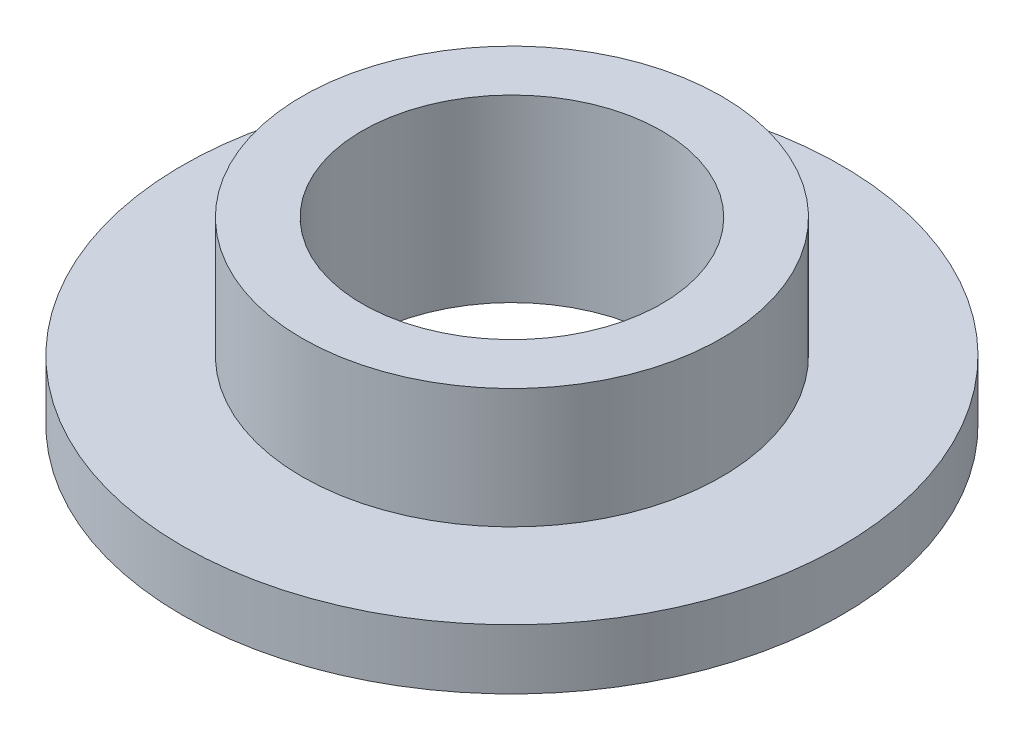
from build123d import *

# Parameters (mm, degrees)
SKETCH5_W           = 1
SKETCH5_H           = 3
SKETCH3_R           = 5.5
SKETCH3_R_2         = 3.5
BOSS_EXTRUDE2_DEPTH = 1


with BuildPart() as part:
    # Sketch5 → Revolve1 (revolve)
    with BuildSketch(Plane(origin=(0, 0, 0), x_dir=(0, 0, -1), z_dir=(1, 0, 0))):
        with Locations((3, 1.5)):
            Rectangle(SKETCH5_W, SKETCH5_H)
    revolve(axis=Axis((0, 0, 0), (0, 1, 0)))

    # Sketch3 → Boss-Extrude2 (add)
    with BuildSketch(Plane(origin=(0, 0, 0), x_dir=(1, 0, 0), z_dir=(0, 1, 0))):
        with Locations(Location((0, 0, 0), (0, 0, 270))):
            Circle(SKETCH3_R)
        with Locations(Location((0, 0, 0), (0, 0, 90))):
            Circle(SKETCH3_R_2, mode=Mode.SUBTRACT)
    extrude(amount=BOSS_EXTRUDE2_DEPTH)


solid = part.part
